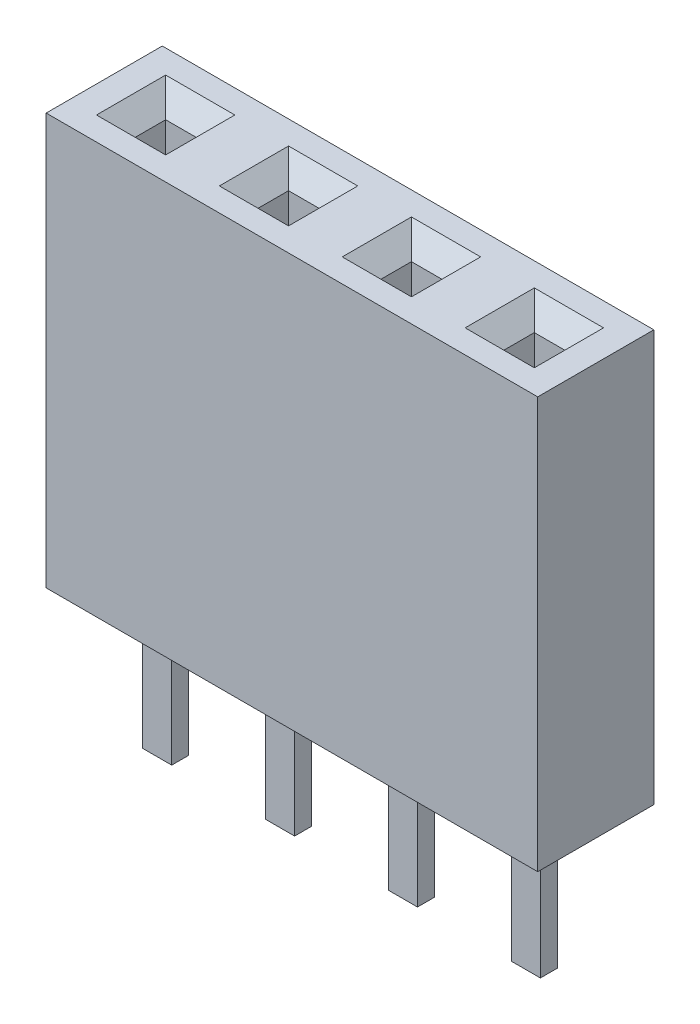
from build123d import *

# Parameters (mm, degrees)
SKETCH1_W           = 38.1
SKETCH1_H           = 2.4
BOSS_EXTRUDE1_DEPTH = 8.5
SKETCH2_W           = 0.63
SKETCH2_H           = 0.63
CUT_EXTRUDE1_DEPTH  = 6.5
SKETCH3_W           = 0.6
SKETCH3_H           = 0.35
BOSS_EXTRUDE2_DEPTH = 2.9
CHAMFER1_SIZE       = 0.4
SKETCH4_W           = 19.378829163
SKETCH4_H           = 4.471478983
CUT_EXTRUDE2_DEPTH  = 23.232914789
SKETCH7_W           = 15.24
SKETCH7_H           = 12.363721619
CUT_EXTRUDE3_DEPTH  = 21.997916563


with BuildPart() as part:
    # Sketch1 → Boss-Extrude1 (new body)
    with BuildSketch(Plane(origin=(0, 0, 0), x_dir=(1, 0, 0), z_dir=(0, 1, 0))):
        Rectangle(SKETCH1_W, SKETCH1_H)
    extrude(amount=BOSS_EXTRUDE1_DEPTH)

    # Sketch2 → Cut-Extrude1 (cut)
    with BuildSketch(Plane(origin=(0, 8.5, 0), x_dir=(1, 0, 0), z_dir=(0, 1, 0))):
        with Locations((-15.24, 0)):
            Rectangle(SKETCH2_W, SKETCH2_H)
        with Locations((-17.78, 0)):
            Rectangle(SKETCH2_W, SKETCH2_H)
        with Locations((-12.7, 0)):
            Rectangle(SKETCH2_W, SKETCH2_H)
        with Locations((-10.16, 0)):
            Rectangle(SKETCH2_W, SKETCH2_H)
        with Locations((-7.62, 0)):
            Rectangle(SKETCH2_W, SKETCH2_H)
        with Locations((-5.08, 0)):
            Rectangle(SKETCH2_W, SKETCH2_H)
        with Locations((-2.54, 0)):
            Rectangle(SKETCH2_W, SKETCH2_H)
        Rectangle(SKETCH2_W, SKETCH2_H)
        with Locations((2.54, 0)):
            Rectangle(SKETCH2_W, SKETCH2_H)
        with Locations((5.08, 0)):
            Rectangle(SKETCH2_W, SKETCH2_H)
        with Locations((7.62, 0)):
            Rectangle(SKETCH2_W, SKETCH2_H)
        with Locations((10.16, 0)):
            Rectangle(SKETCH2_W, SKETCH2_H)
        with Locations((12.7, 0)):
            Rectangle(SKETCH2_W, SKETCH2_H)
        with Locations((15.24, 0)):
            Rectangle(SKETCH2_W, SKETCH2_H)
        with Locations((17.78, 0)):
            Rectangle(SKETCH2_W, SKETCH2_H)
    extrude(amount=-CUT_EXTRUDE1_DEPTH, mode=Mode.SUBTRACT)

    # Sketch3 → Boss-Extrude2 (add)
    with BuildSketch(Plane.XZ):
        with Locations((-15.24, 0)):
            Rectangle(SKETCH3_W, SKETCH3_H)
        with Locations((-17.78, 0)):
            Rectangle(SKETCH3_W, SKETCH3_H)
        with Locations((-12.7, 0)):
            Rectangle(SKETCH3_W, SKETCH3_H)
        with Locations((-10.16, 0)):
            Rectangle(SKETCH3_W, SKETCH3_H)
        with Locations((-7.62, 0)):
            Rectangle(SKETCH3_W, SKETCH3_H)
        with Locations((-5.08, 0)):
            Rectangle(SKETCH3_W, SKETCH3_H)
        with Locations((-2.54, 0)):
            Rectangle(SKETCH3_W, SKETCH3_H)
        Rectangle(SKETCH3_W, SKETCH3_H)
        with Locations((2.54, 0)):
            Rectangle(SKETCH3_W, SKETCH3_H)
        with Locations((5.08, 0)):
            Rectangle(SKETCH3_W, SKETCH3_H)
        with Locations((7.62, 0)):
            Rectangle(SKETCH3_W, SKETCH3_H)
        with Locations((10.16, 0)):
            Rectangle(SKETCH3_W, SKETCH3_H)
        with Locations((12.7, 0)):
            Rectangle(SKETCH3_W, SKETCH3_H)
        with Locations((15.24, 0)):
            Rectangle(SKETCH3_W, SKETCH3_H)
        with Locations((17.78, 0)):
            Rectangle(SKETCH3_W, SKETCH3_H)
    extrude(amount=BOSS_EXTRUDE2_DEPTH)

    # Chamfer1
    chamfer1_edges = [part.edges().sort_by_distance(p)[0] for p in [
        (2.855, 8.5, 0),
        (2.54, 8.5, -0.315),
        (2.225, 8.5, 0),
        (2.54, 8.5, 0.315),
        (5.395, 8.5, 0),
        (5.08, 8.5, -0.315),
        (4.765, 8.5, 0),
        (5.08, 8.5, 0.315),
        (7.935, 8.5, 0),
        (7.62, 8.5, -0.315),
        (7.305, 8.5, 0),
        (7.62, 8.5, 0.315),
        (10.475, 8.5, 0),
        (10.16, 8.5, -0.315),
        (9.845, 8.5, 0),
        (10.16, 8.5, 0.315),
        (13.015, 8.5, 0),
        (12.7, 8.5, -0.315),
        (12.385, 8.5, 0),
        (12.7, 8.5, 0.315),
        (15.555, 8.5, 0),
        (15.24, 8.5, -0.315),
        (14.925, 8.5, 0),
        (15.24, 8.5, 0.315),
        (18.095, 8.5, 0),
        (17.78, 8.5, -0.315),
        (17.465, 8.5, 0),
        (17.78, 8.5, 0.315),
        (-17.465, 8.5, 0),
        (-17.78, 8.5, -0.315),
        (-18.095, 8.5, 0),
        (-17.78, 8.5, 0.315),
        (-14.925, 8.5, 0),
        (-15.24, 8.5, -0.315),
        (-15.555, 8.5, 0),
        (-15.24, 8.5, 0.315),
        (-12.385, 8.5, 0),
        (-12.7, 8.5, -0.315),
        (-13.015, 8.5, 0),
        (-12.7, 8.5, 0.315),
        (-9.845, 8.5, 0),
        (-10.16, 8.5, -0.315),
        (-10.475, 8.5, 0),
        (-10.16, 8.5, 0.315),
        (-7.305, 8.5, 0),
        (-7.62, 8.5, -0.315),
        (-7.935, 8.5, 0),
        (-7.62, 8.5, 0.315),
        (-4.765, 8.5, 0),
        (-5.08, 8.5, -0.315),
        (-5.395, 8.5, 0),
        (-5.08, 8.5, 0.315),
        (-2.225, 8.5, 0),
        (-2.54, 8.5, -0.315),
        (-2.855, 8.5, 0),
        (-2.54, 8.5, 0.315),
        (0.315, 8.5, 0),
        (0, 8.5, -0.315),
        (-0.315, 8.5, 0),
        (0, 8.5, 0.315),
    ]]
    chamfer(chamfer1_edges, length=CHAMFER1_SIZE)

    # Sketch4 → Cut-Extrude2 (cut, through all)
    with BuildSketch(Plane(origin=(0, 8.5, 0), x_dir=(1, 0, 0), z_dir=(0, 1, 0))):
        with Locations((16.039414582, -0.096925096)):
            Rectangle(SKETCH4_W, SKETCH4_H)
    extrude(amount=-CUT_EXTRUDE2_DEPTH, mode=Mode.SUBTRACT)

    # Sketch7 → Cut-Extrude3 (cut, through all)
    with BuildSketch(Plane.XY.offset(1.2)):
        with Locations((-11.43, 2.318139191)):
            Rectangle(SKETCH7_W, SKETCH7_H)
    extrude(amount=-CUT_EXTRUDE3_DEPTH, mode=Mode.SUBTRACT)


solid = part.part
